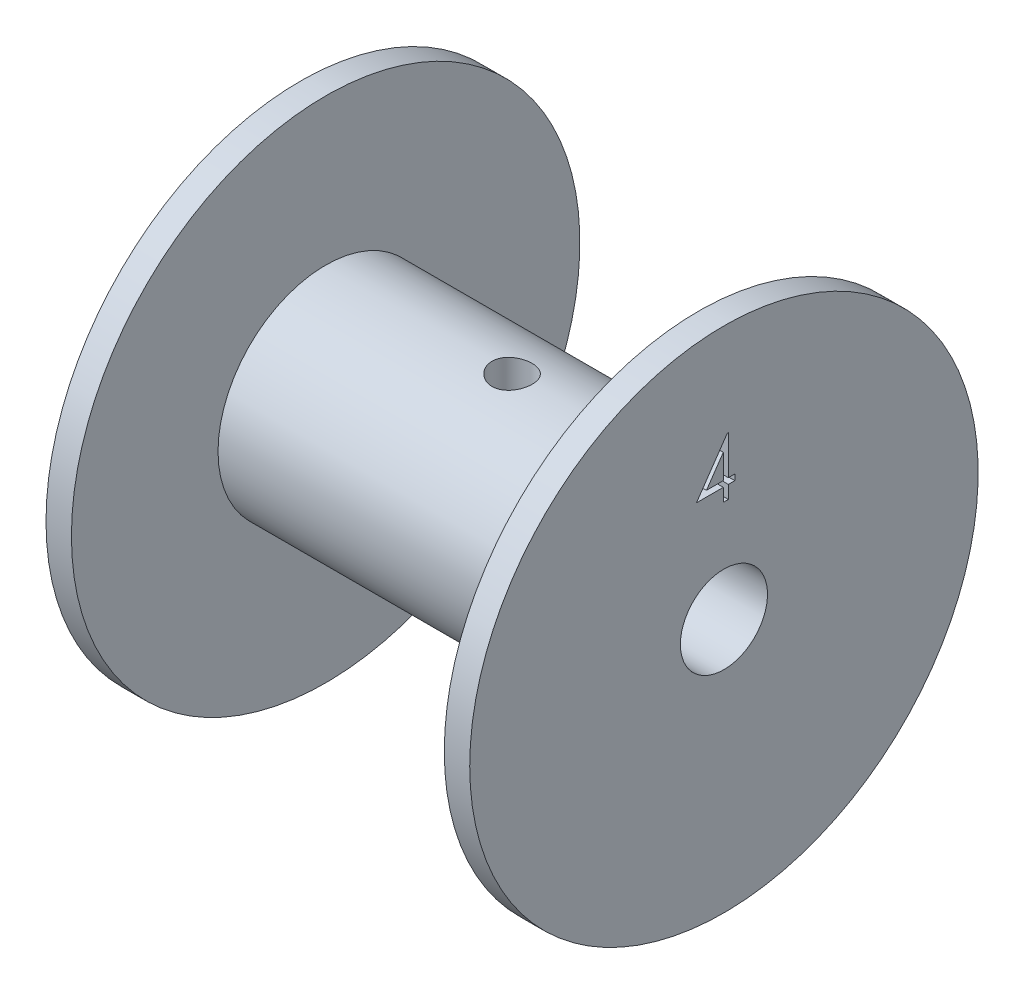
from build123d import *

# Parameters (mm, degrees)
CUT_EXTRUDE1_DEPTH      = 32.270123521
CUT_EXTRUDE1_DEPTH_BACK = 32.270123521
SKETCH2_R               = 1.5
CUT_EXTRUDE2_DEPTH      = 1.27


with BuildPart() as part:
    # Sketch1 → Revolve1 (revolve)
    with BuildSketch(Plane.XY):
        Polygon((15.875, 3.2639), (15.875, 19.05), (13.97, 19.05), (13.97, 8.0645), (-13.97, 8.0645), (-13.97, 19.05), (-15.875, 19.05), (-15.875, 3.2639), align=None)
    revolve(axis=Axis((-15.275524476, 0, 0), (1, 0, 0)))

    # Sketch2 → Cut-Extrude1 (cut, two sides: drawn at the far end of the back side and taken through both)
    with BuildSketch(Plane(origin=(0, 0, 0), x_dir=(1, 0, 0), z_dir=(0, 1, 0)).offset(-CUT_EXTRUDE1_DEPTH_BACK)):
        Circle(SKETCH2_R)
    extrude(amount=CUT_EXTRUDE1_DEPTH + CUT_EXTRUDE1_DEPTH_BACK, mode=Mode.SUBTRACT)

    # Sketch3 → Cut-Extrude2 (cut)
    with BuildSketch(Plane(origin=(15.875, 0, 0), x_dir=(0, 0, -1), z_dir=(1, 0, 0))):
        Polygon((0.253501878, 11.957106949), (0.330672017, 11.957106949), (0.330672017, 9.026337718), (0.819133555, 9.026337718), (0.819133555, 8.592149684), (0.330672017, 8.592149684), (0.330672017, 7.615226607), (-0.049242513, 7.615226607), (-0.049242513, 8.592149684), (-2.057362172, 8.592149684), align=None)
        Polygon((-0.049242513, 9.026337718), (-0.049242513, 10.863156629), (-1.310253464, 9.026337718), align=None, mode=Mode.SUBTRACT)
    extrude(amount=-CUT_EXTRUDE2_DEPTH, mode=Mode.SUBTRACT)


solid = part.part
